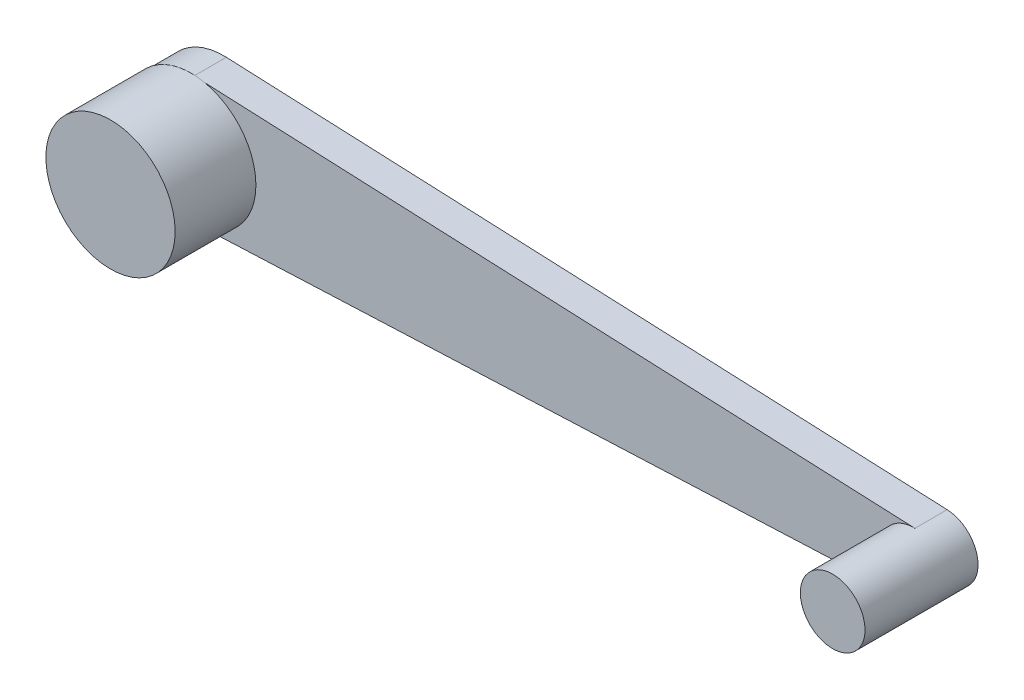
from build123d import *

# Parameters (mm, degrees)
BOSS_EXTRUDE1_DEPTH = 2
SKETCH3_R           = 4
SKETCH3_R_2         = 2
BOSS_EXTRUDE2_DEPTH = 5


with BuildPart() as part:
    # Sketch2 → Boss-Extrude1 (new body)
    with BuildSketch(Plane.XY):
        with BuildLine():
            Line((0.171455577, 3.939749203), (44.786956522, 1.998108747))
            ThreePointArc((44.786956522, 1.998108747), (46.7, 0), (44.786956522, -1.998108747))
            Line((44.786956522, -1.998108747), (0.171455577, -3.939749203))
            ThreePointArc((0.171455577, -3.939749203), (-3.943478261, 0), (0.171455577, 3.939749203))
        make_face()
    extrude(amount=BOSS_EXTRUDE1_DEPTH)

    # Sketch3 → Boss-Extrude2 (add)
    with BuildSketch(Plane.XY.offset(2)):
        with Locations(Location((0, 0, 0), (0, 0, 282.135260603))):
            Circle(SKETCH3_R)
        with Locations(Location((44.7, 0, 0), (0, 0, 272.491906369))):
            Circle(SKETCH3_R_2)
    extrude(amount=BOSS_EXTRUDE2_DEPTH)


solid = part.part
